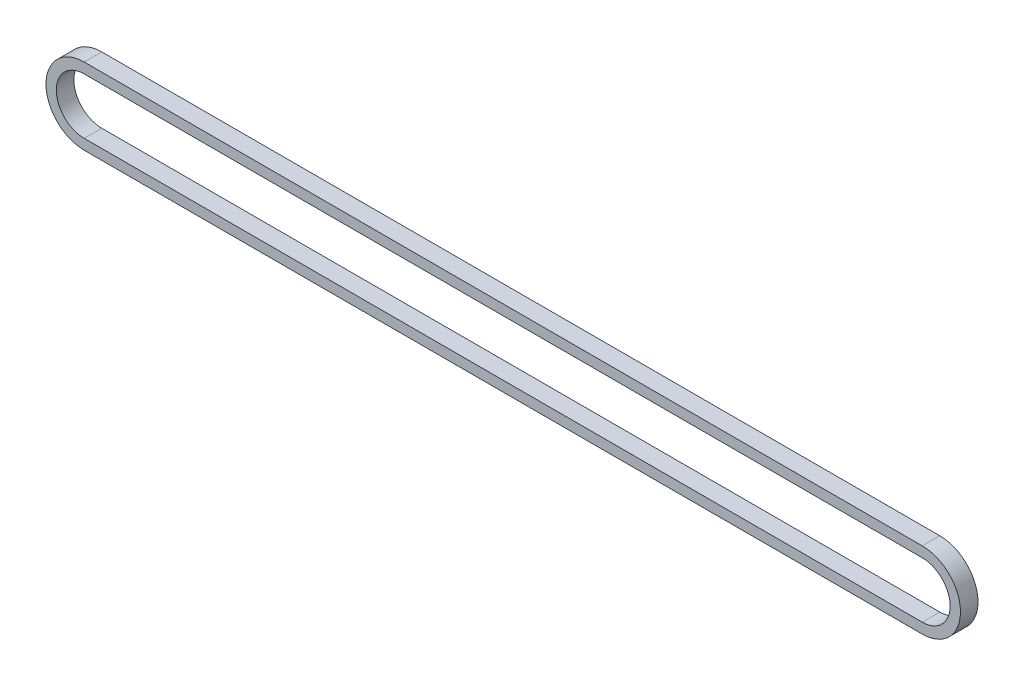
from build123d import *

# Parameters (mm, degrees)
BOSS_EXTRUDE1_DEPTH = 4.25


with BuildPart() as part:
    # Sketch1 → Boss-Extrude1 (new, symmetric)
    with BuildSketch(Plane.XY):
        with BuildLine():
            Line((-203.2, 18.52803), (203.2, 18.52803))
            ThreePointArc((203.2, 18.52803), (221.72803, 0), (203.2, -18.52803))
            Line((203.2, -18.52803), (-203.2, -18.52803))
            ThreePointArc((-203.2, -18.52803), (-221.72803, 0), (-203.2, 18.52803))
        make_face()
        with BuildLine():
            Line((-203.2, 13.52423), (203.2, 13.52423))
            ThreePointArc((203.2, 13.52423), (216.72423, 0), (203.2, -13.52423))
            Line((203.2, -13.52423), (-203.2, -13.52423))
            ThreePointArc((-203.2, -13.52423), (-216.72423, 0), (-203.2, 13.52423))
        make_face(mode=Mode.SUBTRACT)
    extrude(amount=BOSS_EXTRUDE1_DEPTH, both=True)


solid = part.part
